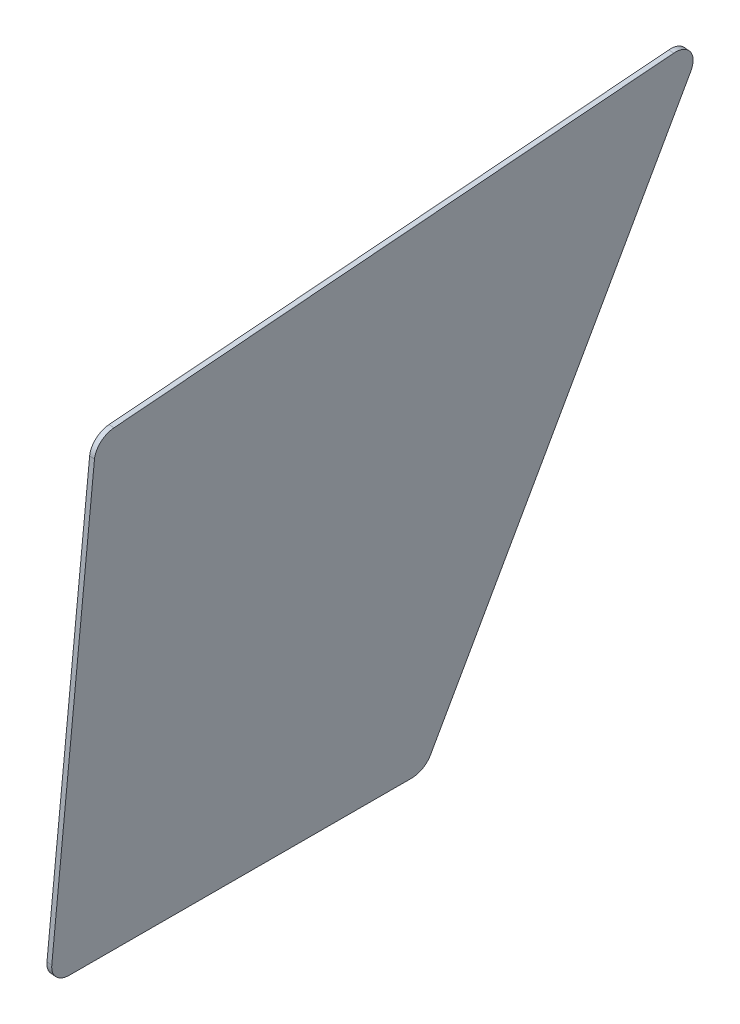
from build123d import *

# Parameters (mm, degrees)
BOSS_EXTRUDE2_DEPTH = 3.175
FILLET1_R           = 12.7


with BuildPart() as part:
    # Sketch2 → Boss-Extrude2 (new body)
    with BuildSketch(Plane(origin=(125.924984682, -11.700540008, 0), x_dir=(0, 0, -1), z_dir=(0.9957109910599374, -0.0925182267579596, 0))):
        Polygon((-1098.963689663, 120.858697524), (-1344.041321718, 121.265601845), (-1344.041321718, 447.57468292), (-948.211534765, 482.774987334), align=None)
    extrude(amount=BOSS_EXTRUDE2_DEPTH)

    # Fillet1
    fillet1_edges = [part.edges().sort_by_distance(p)[0] for p in [
        (138.687308264, 108.492920797, 1098.963689663),
        (138.72495433, 108.898079901, 1344.041321718),
        (168.914491886, 433.807618411, 1344.041321718),
        (172.171161632, 468.856948404, 948.211534765),
    ]]
    fillet(fillet1_edges, radius=FILLET1_R)


solid = part.part
